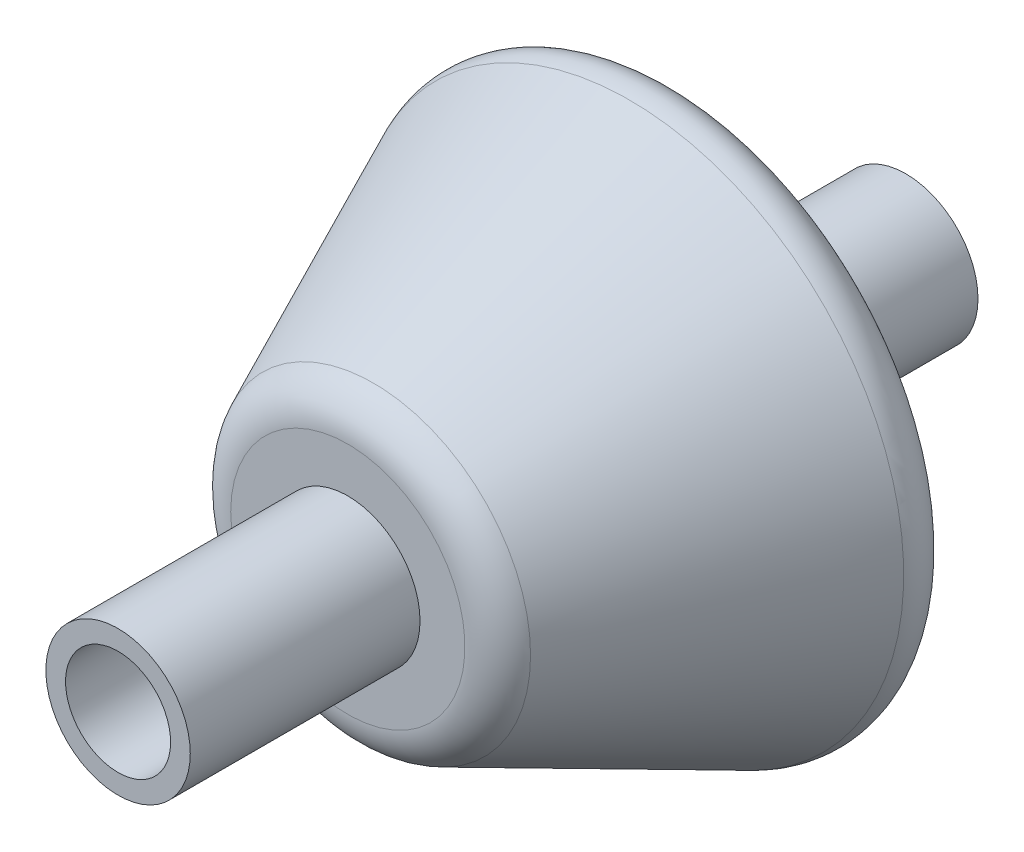
from build123d import *

# Parameters (mm, degrees)
SKETCH1_R           = 11
SKETCH1_R_2         = 8
BOSS_EXTRUDE1_DEPTH = 60


with BuildPart() as part:
    # Sketch1 → Boss-Extrude1 (new, symmetric)
    with BuildSketch(Plane.XY):
        Circle(SKETCH1_R)
        Circle(SKETCH1_R_2, mode=Mode.SUBTRACT)
    extrude(amount=BOSS_EXTRUDE1_DEPTH, both=True)

    # Sketch2 → Revolve1 (revolve)
    with BuildSketch(Plane(origin=(0, 0, 0), x_dir=(0, 0, -1), z_dir=(1, 0, 0)), mode=Mode.PRIVATE) as revolve1_sk:
        with BuildLine():
            Line((-25, 0), (-25, 17.840263865))
            ThreePointArc((-25, 17.840263865), (-23.93794832, 21.458657097), (-21.088750877, 23.929041134))
            Line((-21.088750877, 23.929041134), (17.921053029, 41.76363109))
            ThreePointArc((17.921053029, 41.76363109), (22.702338353, 41.423150362), (25, 37.21632645))
            Line((25, 37.21632645), (25, 0))
            Line((25, 0), (-25, 0))
        make_face()
    revolve(revolve1_sk.sketch.rotate(Axis((0, 0, -25), (0, 0, 1)), 90), axis=Axis((0, 0, -25), (0, 0, 1)))


solid = part.part
